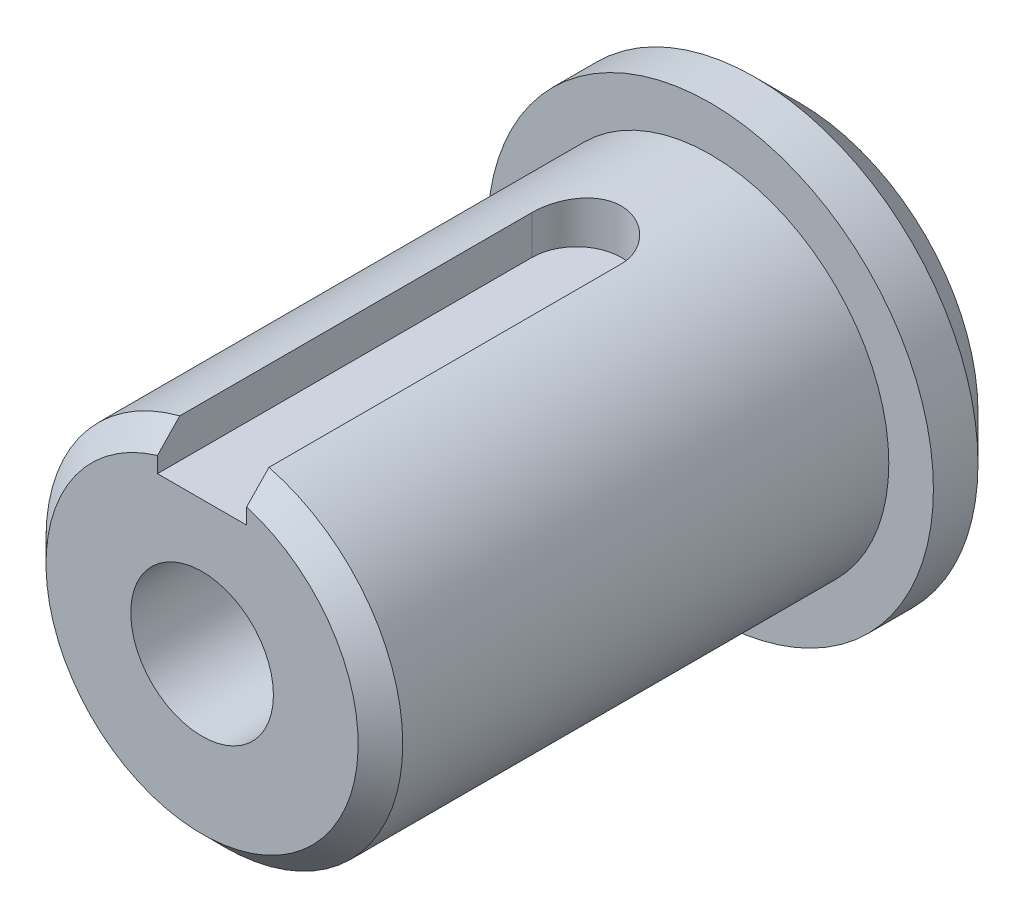
from build123d import *

# Parameters (mm, degrees)
CUT_EXTRUDE1_DEPTH = 1


with BuildPart() as part:
    # Sketch1 → Revolve1 (revolve)
    with BuildSketch(Plane(origin=(0, 0, 0), x_dir=(0, 0, -1), z_dir=(1, 0, 0)), mode=Mode.PRIVATE) as revolve1_sk:
        Polygon((0, 1.6), (0, 4), (-1, 5), (-2, 5), (-2, 4), (-12.9, 4), (-13.4, 3.5), (-13.4, 1.6), align=None)
    revolve(revolve1_sk.sketch.rotate(Axis((0, 0, 0), (0, 0, -1)), 90), axis=Axis((0, 0, 0), (0, 0, -1)))

    # Sketch2 → Cut-Extrude1 (cut)
    with BuildSketch(Plane(origin=(0, 4, 0), x_dir=(1, 0, 0), z_dir=(0, 1, 0))):
        with BuildLine():
            Line((-1, -13.4), (-1, -5))
            ThreePointArc((-1, -5), (0, -4), (1, -5))
            Line((1, -5), (1, -13.4))
            ThreePointArc((1, -13.4), (0, -14.4), (-1, -13.4))
        make_face()
    extrude(amount=-CUT_EXTRUDE1_DEPTH, mode=Mode.SUBTRACT)


solid = part.part
